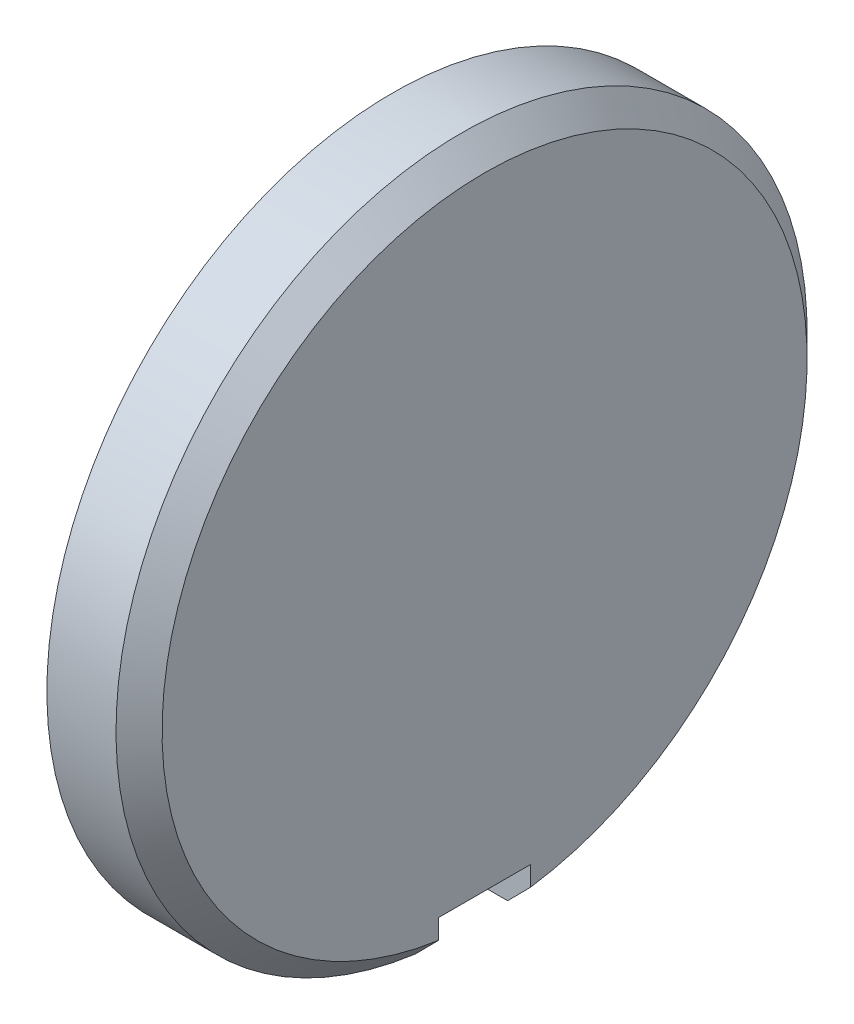
from build123d import *

# Parameters (mm, degrees)
BOSS_EXTRUDE1_START = 62.8
SKETCH2_W           = 1.28
SKETCH2_H           = 0.8
BOSS_EXTRUDE1_DEPTH = 6.4
BOSS_EXTRUDE2_START = 65.6
SKETCH3_W           = 1.28
SKETCH3_H           = 6.4
BOSS_EXTRUDE2_DEPTH = 0.8
BOSS_EXTRUDE3_START = 65.2
SKETCH4_W           = 1.8
SKETCH4_H           = 0.9
BOSS_EXTRUDE3_DEPTH = 1.6


with BuildPart() as part:
    # Sketch1 → Revolve1 (revolve)
    with BuildSketch(Plane.XY.offset(66), mode=Mode.PRIVATE) as revolve1_sk:
        Polygon((74, -17.7), (75.2, -17.7), (75.2, -20), (76.8, -20), (76.8, -14.4), (76.4, -14), (75.2, -14), (75.2, -17), (74, -17), align=None)
    revolve(revolve1_sk.sketch.rotate(Axis((69, -20, 66), (1, 0, 0)), 90), axis=Axis((69, -20, 66), (1, 0, 0)))


with BuildPart() as body_2:
    # Sketch2 → Boss-Extrude1 (new body)
    with BuildSketch(Plane.XY.offset(BOSS_EXTRUDE1_START)):
        with Locations((74.54, -20)):
            Rectangle(SKETCH2_W, SKETCH2_H)
    extrude(amount=BOSS_EXTRUDE1_DEPTH)


with BuildPart() as part_1:
    add(part.part)

    # Combine1: cut body 2
    add(body_2.part, mode=Mode.SUBTRACT)


with BuildPart() as body_2_2:
    # Sketch3 → Boss-Extrude2 (new body)
    with BuildSketch(Plane.XY.offset(BOSS_EXTRUDE2_START)):
        with Locations((74.54, -20)):
            Rectangle(SKETCH3_W, SKETCH3_H)
    extrude(amount=BOSS_EXTRUDE2_DEPTH)


with BuildPart() as part_2:
    add(part_1.part)

    # Combine2: cut body 2 2
    add(body_2_2.part, mode=Mode.SUBTRACT)


with BuildPart() as body_2_3:
    # Sketch4 → Boss-Extrude3 (new body)
    with BuildSketch(Plane.XY.offset(BOSS_EXTRUDE3_START)):
        with Locations((76, -25.65)):
            Rectangle(SKETCH4_W, SKETCH4_H)
    extrude(amount=BOSS_EXTRUDE3_DEPTH)


with BuildPart() as part_3:
    add(part_2.part)

    # Combine3: cut body 2 3
    add(body_2_3.part, mode=Mode.SUBTRACT)


solid = part_3.part
